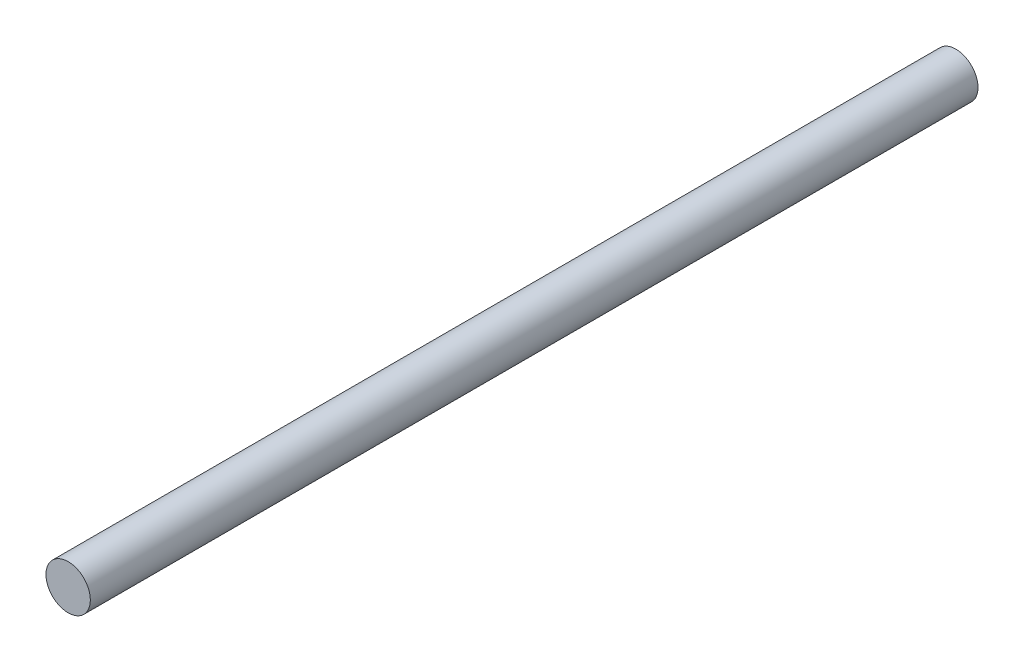
from build123d import *

# Parameters (mm, degrees)
SKETCH2_R           = 2.5
BOSS_EXTRUDE1_DEPTH = 100


with BuildPart() as part:
    # Sketch2 → Boss-Extrude1 (new body)
    with BuildSketch(Plane.XY):
        Circle(SKETCH2_R)
    extrude(amount=BOSS_EXTRUDE1_DEPTH)


solid = part.part
